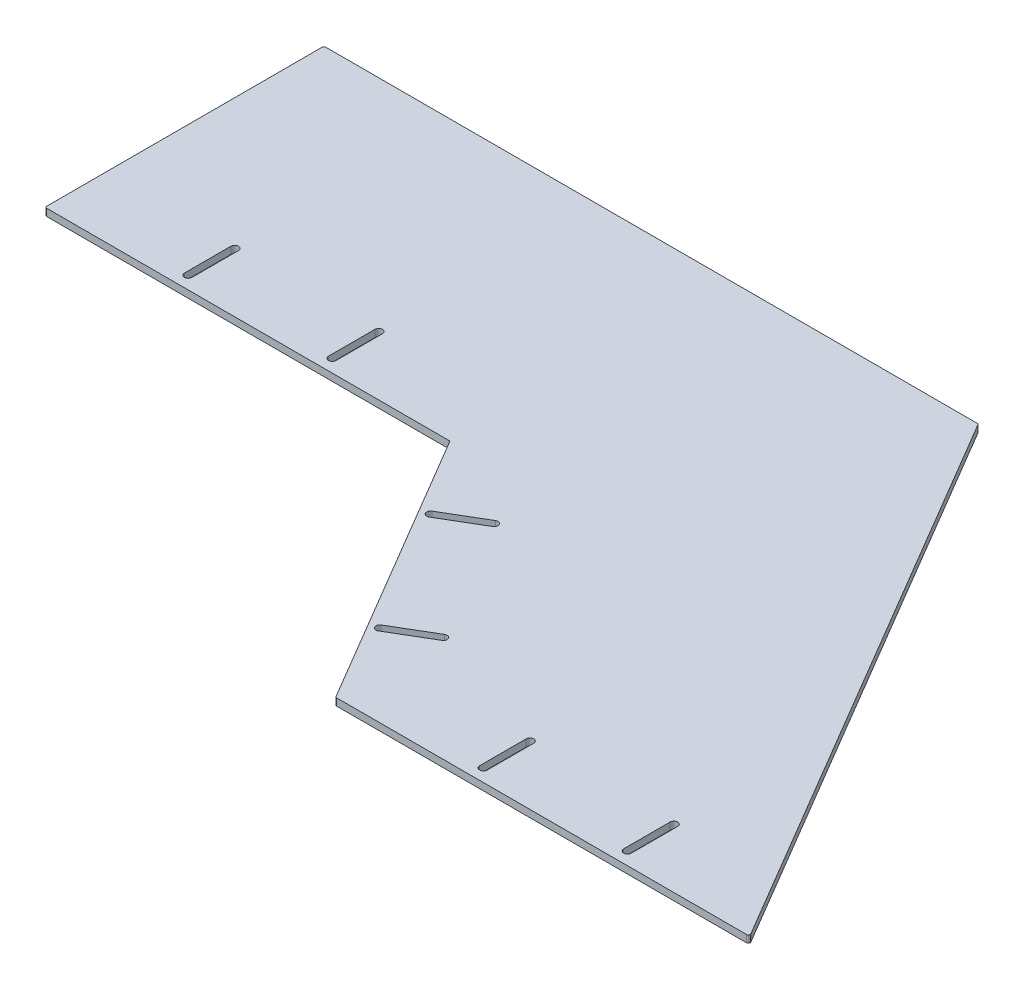
from build123d import *

# Parameters (mm, degrees)
BOSS_EXTRUDE1_DEPTH = 4
FILLET1_R           = 1


with BuildPart() as part:
    # Sketch1 → Boss-Extrude1 (new body)
    with BuildSketch(Plane(origin=(0, 0, 0), x_dir=(-1, 0, 0), z_dir=(0, 1, 0))):
        Polygon((363.484973911, 0), (0, 0), (-183.030052177, 310), (46.969947823, 310), (138.484973911, 155), (363.484973911, 155), align=None)
        with BuildLine():
            ThreePointArc((288.884973911, 122.1), (290.984973911, 120), (293.084973911, 122.1))
            Line((293.084973911, 122.1), (293.084973911, 147.9))
            ThreePointArc((293.084973911, 147.9), (290.984973911, 150), (288.884973911, 147.9))
            Line((288.884973911, 147.9), (288.884973911, 122.1))
        make_face(mode=Mode.SUBTRACT)
        with BuildLine():
            ThreePointArc((69.152908152, 262.594027053), (69.893566181, 265.470035691), (67.017557543, 266.21069372))
            Line((67.017557543, 266.21069372), (44.800890876, 253.09353998))
            ThreePointArc((44.800890876, 253.09353998), (44.060232847, 250.217531343), (46.936241485, 249.476873314))
            Line((46.936241485, 249.476873314), (69.152908152, 262.594027053))
        make_face(mode=Mode.SUBTRACT)
        with BuildLine():
            ThreePointArc((-110.130052177, 277.1), (-108.030052177, 275), (-105.930052177, 277.1))
            Line((-105.930052177, 277.1), (-105.930052177, 302.9))
            ThreePointArc((-105.930052177, 302.9), (-108.030052177, 305), (-110.130052177, 302.9))
            Line((-110.130052177, 302.9), (-110.130052177, 277.1))
        make_face(mode=Mode.SUBTRACT)
        with BuildLine():
            Line((-25.930052177, 302.9), (-25.930052177, 277.1))
            ThreePointArc((-25.930052177, 277.1), (-28.030052177, 275), (-30.130052177, 277.1))
            Line((-30.130052177, 277.1), (-30.130052177, 302.9))
            ThreePointArc((-30.130052177, 302.9), (-28.030052177, 305), (-25.930052177, 302.9))
        make_face(mode=Mode.SUBTRACT)
        with BuildLine():
            Line((85.474235805, 184.204651092), (107.690902471, 197.321804831))
            ThreePointArc((107.690902471, 197.321804831), (110.566911109, 196.581146802), (109.82625308, 193.705138164))
            Line((109.82625308, 193.705138164), (87.609586413, 180.587984425))
            ThreePointArc((87.609586413, 180.587984425), (84.733577776, 181.328642454), (85.474235805, 184.204651092))
        make_face(mode=Mode.SUBTRACT)
        with BuildLine():
            Line((213.084973911, 147.9), (213.084973911, 122.1))
            ThreePointArc((213.084973911, 122.1), (210.984973911, 120), (208.884973911, 122.1))
            Line((208.884973911, 122.1), (208.884973911, 147.9))
            ThreePointArc((208.884973911, 147.9), (210.984973911, 150), (213.084973911, 147.9))
        make_face(mode=Mode.SUBTRACT)
    extrude(amount=BOSS_EXTRUDE1_DEPTH)

    # Fillet1
    fillet1_edges = [part.edges().sort_by_distance(p)[0] for p in [
        (0, 2, 0),
        (183.030052177, 2, 310),
        (-46.969947823, 2, 310),
        (-138.484973911, 2, 155),
        (-363.484973911, 2, 155),
        (-363.484973911, 2, 0),
    ]]
    fillet(fillet1_edges, radius=FILLET1_R)


solid = part.part
